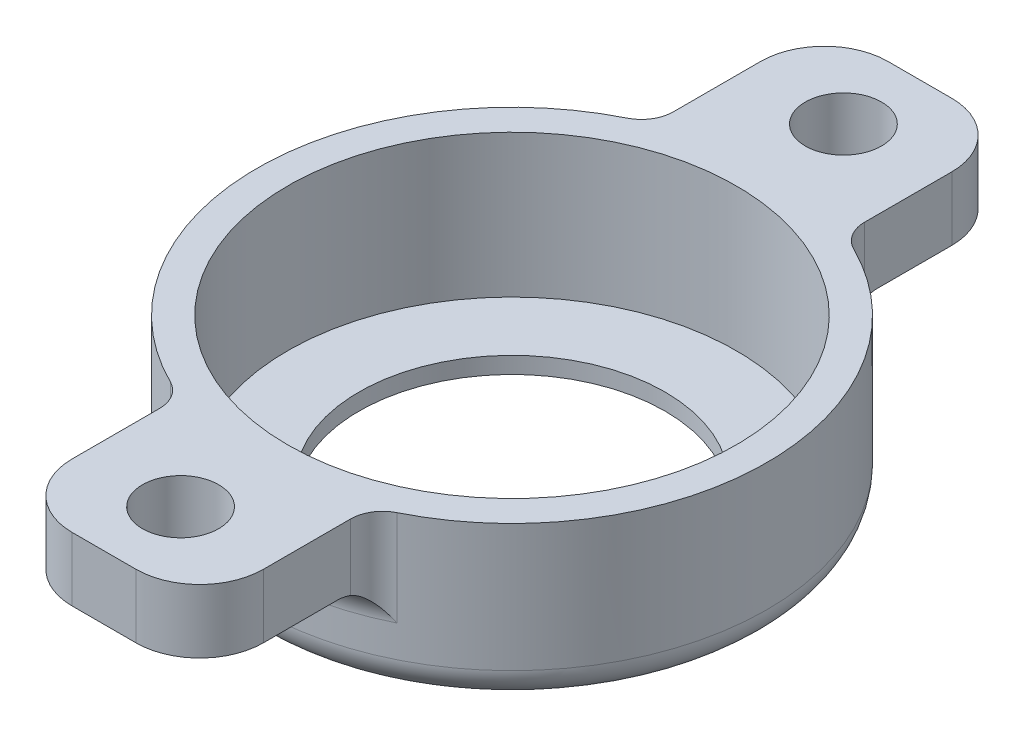
from build123d import *

# Parameters (mm, degrees)
SKETCH1_R                = 12.7
BOSS_EXTRUDE1_DEPTH      = 7.9375
SKETCH3_R                = 7.62
CUT_EXTRUDE2_DEPTH       = 20.636290542
SKETCH4_R                = 11.176
CUT_EXTRUDE3_DEPTH       = 7.112
BOSS_EXTRUDE2_START      = -3.175
BOSS_EXTRUDE2_DEPTH      = 3.175
SKETCH6_R                = 1.9
CUT_EXTRUDE4_DEPTH       = 26.242747597
FILLET1_R                = 3.175
CIRPATTERN1_COUNT        = 2
FILLET1_OF_CIRPATTERN1_R = 3.175
FILLET2_R                = 1.5875


with BuildPart() as part:
    # Sketch1 → Boss-Extrude1 (new body)
    with BuildSketch(Plane(origin=(0, 0, 0), x_dir=(1, 0, 0), z_dir=(0, 1, 0))):
        with Locations(Location((0, 0, 0), (0, 0, 270))):
            Circle(SKETCH1_R)
    extrude(amount=BOSS_EXTRUDE1_DEPTH)

    # Sketch3 → Cut-Extrude2 (cut, through all)
    with BuildSketch(Plane(origin=(0, 7.9375, 0), x_dir=(1, 0, 0), z_dir=(0, 1, 0))):
        with Locations(Location((0, 0, 0), (0, 0, 270))):
            Circle(SKETCH3_R)
    extrude(amount=-CUT_EXTRUDE2_DEPTH, mode=Mode.SUBTRACT)

    # Sketch4 → Cut-Extrude3 (cut)
    with BuildSketch(Plane(origin=(0, 7.9375, 0), x_dir=(1, 0, 0), z_dir=(0, 1, 0))):
        with Locations(Location((0, 0, 0), (0, 0, 270))):
            Circle(SKETCH4_R)
    extrude(amount=-CUT_EXTRUDE3_DEPTH, mode=Mode.SUBTRACT)

    # Sketch5 → Boss-Extrude2 (add)
    with BuildSketch(Plane(origin=(0, 7.9375, 0), x_dir=(1, 0, 0), z_dir=(0, 1, 0)).offset(BOSS_EXTRUDE2_START)):
        with BuildLine():
            Line((-4.7625, 11.773215098), (-4.7625, 20.32))
            Line((-4.7625, 20.32), (4.7625, 20.32))
            Line((4.7625, 20.32), (4.7625, 11.773215098))
            ThreePointArc((4.7625, 11.773215098), (0, 12.7), (-4.7625, 11.773215098))
        make_face()
    boss_extrude2 = extrude(amount=BOSS_EXTRUDE2_DEPTH)

    # Sketch6 → Cut-Extrude4 (cut, symmetric)
    with BuildSketch(Plane(origin=(0, 7.9375, 0), x_dir=(1, 0, 0), z_dir=(0, 1, 0))):
        with Locations(Location((0, 16.51, 0), (0, 0, 270))):
            Circle(SKETCH6_R)
    cut_extrude4 = extrude(amount=CUT_EXTRUDE4_DEPTH, both=True, mode=Mode.SUBTRACT)

    # Fillet1
    fillet1_edges = [part.edges().sort_by_distance(p)[0] for p in [
        (-4.7625, 6.35, -20.32),
        (4.7625, 6.35, -20.32),
    ]]
    fillet(fillet1_edges, radius=FILLET1_R)

    # CirPattern1: Boss-Extrude2, Cut-Extrude4 ×2 about axis
    cirpattern1_axis = Axis((0, 0, 0), (0, 1, 0))
    add([boss_extrude2.rotate(cirpattern1_axis, i * 360 / CIRPATTERN1_COUNT) for i in range(1, CIRPATTERN1_COUNT)])
    add([cut_extrude4.rotate(cirpattern1_axis, i * 360 / CIRPATTERN1_COUNT) for i in range(1, CIRPATTERN1_COUNT)], mode=Mode.SUBTRACT)

    # Fillet1 of CirPattern1
    fillet1_of_cirpattern1_edges = [part.edges().sort_by_distance(p)[0] for p in [
        (4.7625, 6.35, 20.32),
        (-4.7625, 6.35, 20.32),
    ]]
    fillet(fillet1_of_cirpattern1_edges, radius=FILLET1_OF_CIRPATTERN1_R)

    # Fillet2
    fillet2_edges = [part.edges().sort_by_distance(p)[0] for p in [
        (0, 4.7625, -12.7),
        (4.7625, 6.35, -11.773215098),
        (-4.7625, 6.35, -11.773215098),
        (0, 0, -12.7),
        (-2.425919233, 4.7625, 12.466150804),
        (-4.7625, 6.35, 11.773215098),
        (4.7625, 6.35, 11.773215098),
    ]]
    fillet(fillet2_edges, radius=FILLET2_R)


solid = part.part
